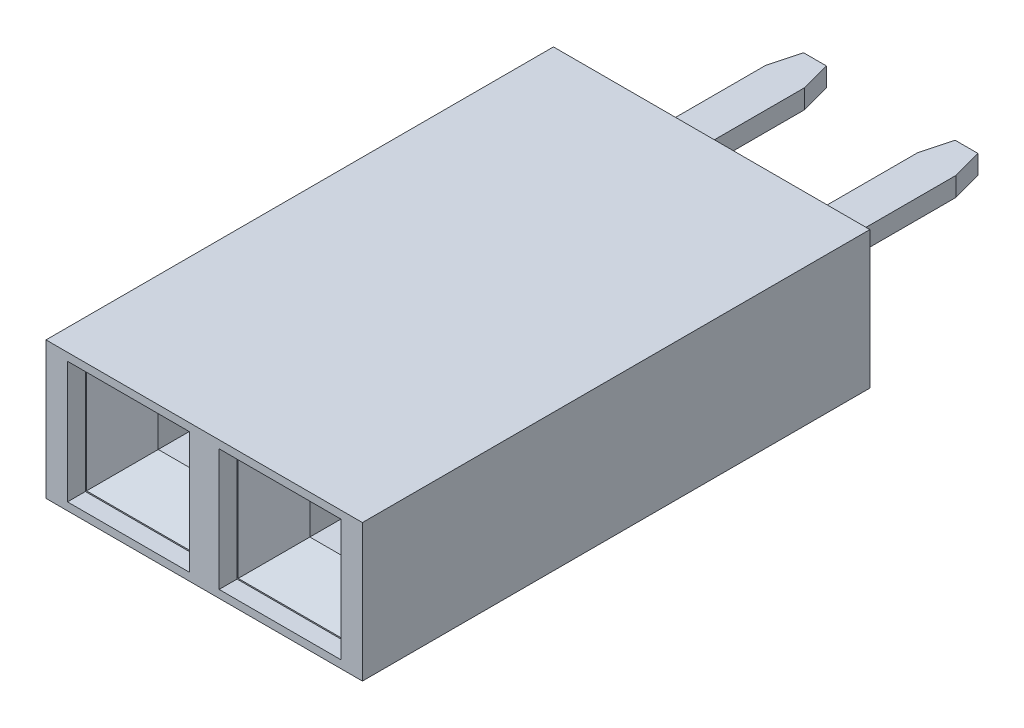
from build123d import *
from OCP.BRepFilletAPI import BRepFilletAPI_MakeChamfer

# Parameters (mm, degrees)
SKETCH_1_W          = 5.3
SKETCH_1_H          = 2.3
EXTRUDE_1_DEPTH     = 4.25
SKETCH_2_W          = 0.8
SKETCH_2_H          = 0.8
CUT_EXTRUDE_1_DEPTH = 8
SKETCH_3_W          = 2.04
SKETCH_3_H          = 2.04
CUT_EXTRUDE_2_DEPTH = 0.3
CHAMFER_1_SIZE      = 0.6
SKETCH_4_W          = 0.65
SKETCH_4_H          = 0.32
EXTRUDE_2_DEPTH     = 3
CHAMFER_2_SIZE      = 0.5
CHAMFER_2_SIZE2     = 0.133974596


with BuildPart() as part:
    # 草图1 → 凸台-拉伸1 (new, symmetric)
    with BuildSketch(Plane.XY):
        Rectangle(SKETCH_1_W, SKETCH_1_H)
    extrude(amount=EXTRUDE_1_DEPTH, both=True)

    # 草图2 → 切除-拉伸1 (cut)
    with BuildSketch(Plane.XY.offset(4.25)):
        with Locations((-1.27, 0)):
            Rectangle(SKETCH_2_W, SKETCH_2_H)
        with Locations((1.27, 0)):
            Rectangle(SKETCH_2_W, SKETCH_2_H)
    extrude(amount=-CUT_EXTRUDE_1_DEPTH, mode=Mode.SUBTRACT)

    # 草图3 → 切除-拉伸2 (cut)
    with BuildSketch(Plane.XY.offset(4.25)):
        with Locations((-1.27, 0)):
            Rectangle(SKETCH_3_W, SKETCH_3_H)
        with Locations((1.27, 0)):
            Rectangle(SKETCH_3_W, SKETCH_3_H)
    extrude(amount=-CUT_EXTRUDE_2_DEPTH, mode=Mode.SUBTRACT)

    # 倒角1
    chamfer_1_edges = [part.edges().sort_by_distance(p)[0] for p in [
        (-1.27, -0.4, 3.95),
        (1.27, -0.4, 3.95),
        (-1.67, 0, 3.95),
        (-1.27, 0.4, 3.95),
        (-0.87, 0, 3.95),
        (1.27, 0.4, 3.95),
        (0.87, 0, 3.95),
        (1.67, 0, 3.95),
    ]]
    chamfer(chamfer_1_edges, length=CHAMFER_1_SIZE)

    # 草图4 → 凸台-拉伸2 (add)
    with BuildSketch(Plane(origin=(0, 0, -4.25), x_dir=(-1, 0, 0), z_dir=(0, 0, -1))):
        with Locations((-1.27, 0)):
            Rectangle(SKETCH_4_W, SKETCH_4_H)
        with Locations((1.27, 0)):
            Rectangle(SKETCH_4_W, SKETCH_4_H)
    extrude(amount=EXTRUDE_2_DEPTH)

    # 倒角2: one chamfer whose edges measure the first distance from different faces: ONE call of the kernel's chamfer builder (chamfer() names one face for all edges)
    chamfer_2_edges_1 = [part.edges().sort_by_distance(p)[0] for p in [
        (1.595, 0, -7.25),
    ]]
    chamfer_2_side_1 = [part.faces().sort_by_distance(p)[0] for p in [
        (1.595, 0, -5.75),
    ]]
    chamfer_2_edges_2 = [part.edges().sort_by_distance(p)[0] for p in [
        (0.945, 0, -7.25),
    ]]
    chamfer_2_side_2 = [part.faces().sort_by_distance(p)[0] for p in [
        (0.945, 0, -5.75),
    ]]
    chamfer_2_edges_3 = [part.edges().sort_by_distance(p)[0] for p in [
        (-0.945, 0, -7.25),
    ]]
    chamfer_2_side_3 = [part.faces().sort_by_distance(p)[0] for p in [
        (-0.945, 0, -5.75),
    ]]
    chamfer_2_edges_4 = [part.edges().sort_by_distance(p)[0] for p in [
        (-1.595, 0, -7.25),
    ]]
    chamfer_2_side_4 = [part.faces().sort_by_distance(p)[0] for p in [
        (-1.595, 0, -5.75),
    ]]
    chamfer_2 = BRepFilletAPI_MakeChamfer(part.part.solid().wrapped)
    for e in chamfer_2_edges_1:
        chamfer_2.Add(CHAMFER_2_SIZE, CHAMFER_2_SIZE2, e.wrapped, chamfer_2_side_1[0].wrapped)  # the first distance lies on this face
    for e in chamfer_2_edges_2:
        chamfer_2.Add(CHAMFER_2_SIZE, CHAMFER_2_SIZE2, e.wrapped, chamfer_2_side_2[0].wrapped)  # the first distance lies on this face
    for e in chamfer_2_edges_3:
        chamfer_2.Add(CHAMFER_2_SIZE, CHAMFER_2_SIZE2, e.wrapped, chamfer_2_side_3[0].wrapped)  # the first distance lies on this face
    for e in chamfer_2_edges_4:
        chamfer_2.Add(CHAMFER_2_SIZE, CHAMFER_2_SIZE2, e.wrapped, chamfer_2_side_4[0].wrapped)  # the first distance lies on this face
    add(Compound.cast(chamfer_2.Shape()), mode=Mode.REPLACE)


solid = part.part
